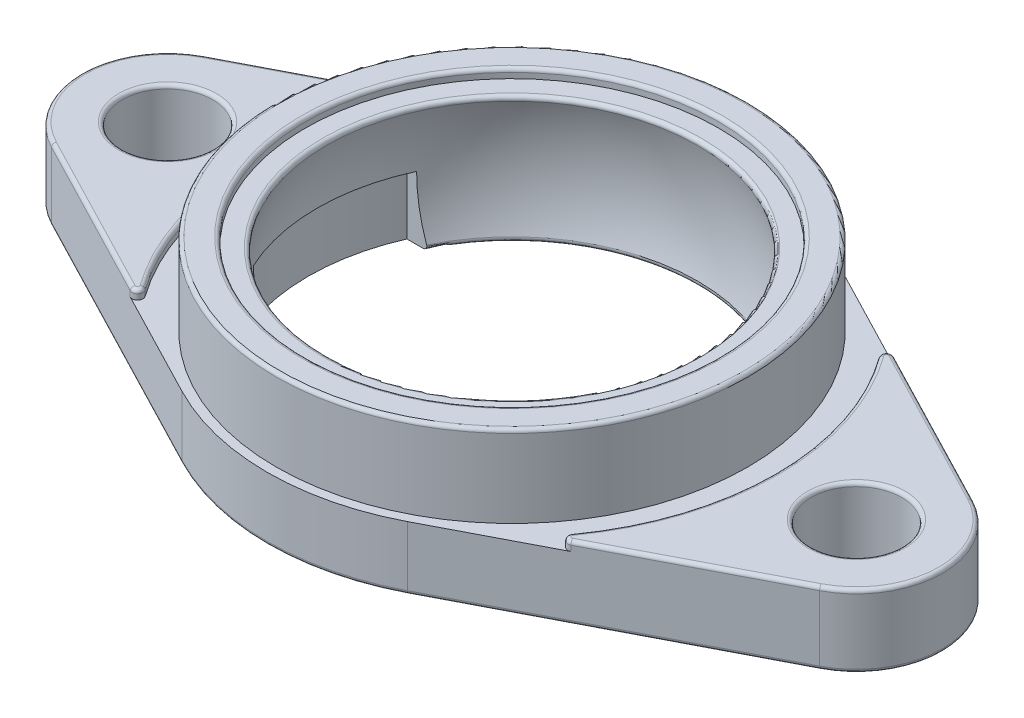
from build123d import *

# Parameters (mm, degrees)
SKETCH5_R           = 2.5
SKETCH5_R_2         = 13
BOSS_EXTRUDE3_DEPTH = 4
CUT_EXTRUDE1_DEPTH  = 0.5
SKETCH7_R           = 14.5
SKETCH7_R_2         = 13
CUT_EXTRUDE2_DEPTH  = 0.5
FILLET1_R           = 0.3
FILLET2_R           = 0.2
CUT_EXTRUDE3_DEPTH  = 3.5


with BuildPart() as part:
    # Sketch5 → Boss-Extrude3 (new body)
    with BuildSketch(Plane(origin=(0, -4, 0), x_dir=(1, 0, 0), z_dir=(0, 1, 0))):
        with BuildLine():
            Line((-21.1875, 4.216318744), (-6.217105263, 11.983221693))
            ThreePointArc((-6.217105263, 11.983221693), (0, 13.5), (6.217105263, 11.983221693))
            Line((6.217105263, 11.983221693), (21.1875, 4.216318744))
            ThreePointArc((21.1875, 4.216318744), (23.75, 0), (21.1875, -4.216318744))
            Line((21.1875, -4.216318744), (6.217105263, -11.983221693))
            ThreePointArc((6.217105263, -11.983221693), (0, -13.5), (-6.217105263, -11.983221693))
            Line((-6.217105263, -11.983221693), (-21.1875, -4.216318744))
            ThreePointArc((-21.1875, -4.216318744), (-23.75, 0), (-21.1875, 4.216318744))
        make_face()
        with Locations((-19, 0)):
            Circle(SKETCH5_R, mode=Mode.SUBTRACT)
        with Locations((19, 0)):
            Circle(SKETCH5_R, mode=Mode.SUBTRACT)
        Circle(SKETCH5_R_2, mode=Mode.SUBTRACT)
    extrude(amount=BOSS_EXTRUDE3_DEPTH)

    # Sketch2 → Revolve2 (revolve)
    with BuildSketch(Plane.XY):
        with BuildLine():
            ThreePointArc((10.164275675, 3.5), (10.746689479, -0.266768159), (9.978101022, -4))
            Line((9.978101022, -4), (13, -4))
            Line((13, -4), (13, 4))
            Line((13, 4), (11.4, 4))
            Line((11.4, 4), (11.4, 3.5))
            Line((11.4, 3.5), (10.164275675, 3.5))
        make_face()
    revolve(axis=Axis((0, 0, 0), (0, 1, 0)))

    # Sketch6 → Cut-Extrude1 (cut)
    with BuildSketch(Plane.XZ.offset(4)):
        with BuildLine():
            Line((5.480263158, -10.562988011), (15.987642753, -5.111575473))
            ThreePointArc((15.987642753, -5.111575473), (16.416112044, -4.471926924), (16.106541095, -3.767014144))
            ThreePointArc((16.106541095, -3.767014144), (14.25, 0), (16.106541095, 3.767014144))
            ThreePointArc((16.106541095, 3.767014144), (16.416112044, 4.471926924), (15.987642753, 5.111575473))
            Line((15.987642753, 5.111575473), (5.480263158, 10.562988011))
            ThreePointArc((5.480263158, 10.562988011), (0, 11.9), (-5.480263158, 10.562988011))
            Line((-5.480263158, 10.562988011), (-15.987642753, 5.111575473))
            ThreePointArc((-15.987642753, 5.111575473), (-16.416112044, 4.471926924), (-16.106541095, 3.767014144))
            ThreePointArc((-16.106541095, 3.767014144), (-14.25, 0), (-16.106541095, -3.767014144))
            ThreePointArc((-16.106541095, -3.767014144), (-16.416112044, -4.471926924), (-15.987642753, -5.111575473))
            Line((-15.987642753, -5.111575473), (-5.480263158, -10.562988011))
            ThreePointArc((-5.480263158, -10.562988011), (0, -11.9), (5.480263158, -10.562988011))
        make_face()
    extrude(amount=-CUT_EXTRUDE1_DEPTH, mode=Mode.SUBTRACT)

    # Sketch7 → Cut-Extrude2 (cut)
    with BuildSketch(Plane(origin=(0, 0, 0), x_dir=(1, 0, 0), z_dir=(0, 1, 0))):
        Circle(SKETCH7_R)
        Circle(SKETCH7_R_2, mode=Mode.SUBTRACT)
    extrude(amount=-CUT_EXTRUDE2_DEPTH, mode=Mode.SUBTRACT)

    # Fillet1
    fillet1_edges = [part.edges().sort_by_distance(p)[0] for p in [
        (10.914086671, -0.25, 9.546345486),
        (10.914086671, -0.25, -9.546345486),
        (-10.914086671, -0.25, -9.546345486),
        (-10.914086671, -0.25, 9.546345486),
    ]]
    fillet(fillet1_edges, radius=FILLET1_R)

    # Fillet2
    fillet2_edges = [part.edges().sort_by_distance(p)[0] for p in [
        (16.416112044, -4, 4.471926924),
        (10.733952955, -4, 7.837281742),
        (0, -4, 11.9),
        (-10.733952955, -4, 7.837281742),
        (-16.416112044, -4, 4.471926924),
        (-14.25, -4, 0),
        (-16.416112044, -4, -4.471926924),
        (-10.733952955, -4, -7.837281742),
        (0, -4, -11.9),
        (10.733952955, -4, -7.837281742),
        (16.416112044, -4, -4.471926924),
        (14.25, -4, 0),
        (-13.702302632, -4, 8.099770219),
        (0, -4, 13.5),
        (13.702302632, -4, 8.099770219),
        (23.75, -4, 0),
        (13.702302632, -4, -8.099770219),
        (0, -4, -13.5),
        (-13.702302632, -4, -8.099770219),
        (-23.75, -4, 0),
        (16.5, -4, 0),
        (-21.5, -4, 0),
        (-11.4, 4, 0),
        (-13, 4, 0),
        (16.5, 0, 0),
        (11.793335472, 0, -8.830780282),
        (16.672934507, 0, -6.55855438),
        (23.75, 0, 0),
        (16.672934507, 0, 6.55855438),
        (11.793335472, 0, 8.830780282),
        (14.5, 0, 0),
        (-21.5, 0, 0),
        (-11.793335472, 0, 8.830780282),
        (-16.672934507, 0, 6.55855438),
        (-23.75, 0, 0),
        (-16.672934507, 0, -6.55855438),
        (-11.793335472, 0, -8.830780282),
        (-14.5, 0, 0),
        (-10.164275675, -3.5, 0),
        (-10.164275675, 3.5, 0),
    ]]
    fillet(fillet2_edges, radius=FILLET2_R)

    # Sketch8 → Cut-Extrude3 (cut)
    with BuildSketch(Plane.XZ.offset(3.5)):
        with BuildLine():
            Line((-10.300871236, 4.5), (10.300871236, 4.5))
            ThreePointArc((10.300871236, 4.5), (11.240905133, 0), (10.300871236, -4.5))
            Line((10.300871236, -4.5), (-10.300871236, -4.5))
            ThreePointArc((-10.300871236, -4.5), (-11.240905133, 0), (-10.300871236, 4.5))
        make_face()
    extrude(amount=-CUT_EXTRUDE3_DEPTH, mode=Mode.SUBTRACT)


solid = part.part
